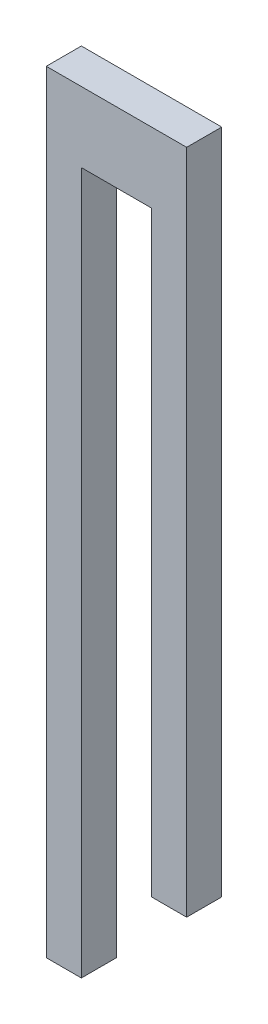
from build123d import *

# Parameters (mm, degrees)
SKETCH2_W           = 20
SKETCH2_H           = 5
BOSS_EXTRUDE1_DEPTH = 10
SKETCH5_W           = 5
SKETCH5_H           = 5
BOSS_EXTRUDE2_DEPTH = 100
SKETCH6_W           = 5
SKETCH6_H           = 5
BOSS_EXTRUDE3_DEPTH = 85


with BuildPart() as part:
    # Sketch2 → Boss-Extrude1 (new body)
    with BuildSketch(Plane(origin=(0, 0, 0), x_dir=(1, 0, 0), z_dir=(0, 1, 0))):
        Rectangle(SKETCH2_W, SKETCH2_H)
    extrude(amount=BOSS_EXTRUDE1_DEPTH)

    # Sketch5 → Boss-Extrude2 (add)
    with BuildSketch(Plane(origin=(0, 0, 0), x_dir=(1, 0, 0), z_dir=(0, 1, 0))):
        with Locations((-7.5, 0)):
            Rectangle(SKETCH5_W, SKETCH5_H)
    extrude(amount=-BOSS_EXTRUDE2_DEPTH)

    # Sketch6 → Boss-Extrude3 (add)
    with BuildSketch(Plane.XZ):
        with Locations((7.5, 0)):
            Rectangle(SKETCH6_W, SKETCH6_H)
    extrude(amount=BOSS_EXTRUDE3_DEPTH)


solid = part.part
